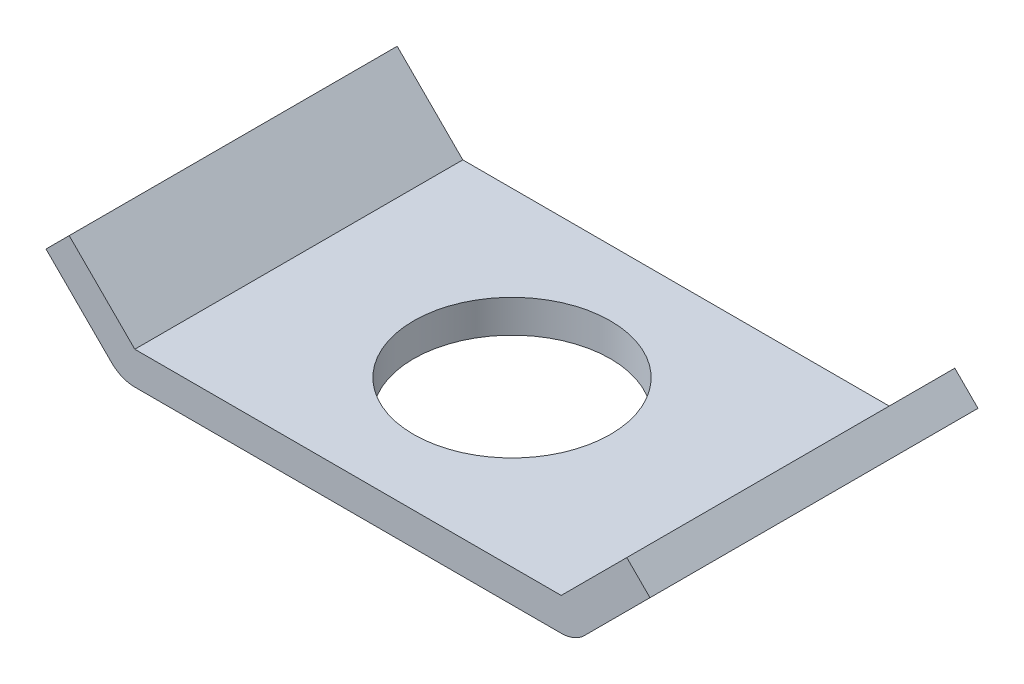
from build123d import *

# Parameters (mm, degrees)
BOSS_EXTRUDE1_DEPTH = 2.5
SKETCH2_R           = 1.5
CUT_EXTRUDE1_DEPTH  = 5


with BuildPart() as part:
    # Sketch1 → Boss-Extrude1 (new, symmetric)
    with BuildSketch(Plane.XY):
        with BuildLine():
            Line((-3.25, 0), (3.25, 0))
            Line((3.25, 0), (4.25, 1))
            Line((4.25, 1), (4.603553391, 0.646446609))
            Line((4.603553391, 0.646446609), (3.603553391, -0.353553391))
            ThreePointArc((3.603553391, -0.353553391), (3.441341716, -0.461939766), (3.25, -0.5))
            Line((3.25, -0.5), (-3.25, -0.5))
            ThreePointArc((-3.25, -0.5), (-3.441341716, -0.461939766), (-3.603553391, -0.353553391))
            Line((-3.603553391, -0.353553391), (-4.603553391, 0.646446609))
            Line((-4.603553391, 0.646446609), (-4.25, 1))
            Line((-4.25, 1), (-3.25, 0))
        make_face()
    extrude(amount=BOSS_EXTRUDE1_DEPTH, both=True)

    # Sketch2 → Cut-Extrude1 (cut)
    with BuildSketch(Plane.XZ.offset(0.5)):
        with Locations(Location((0, 0, 0), (0, 0, 270))):
            Circle(SKETCH2_R)
    extrude(amount=-CUT_EXTRUDE1_DEPTH, mode=Mode.SUBTRACT)


solid = part.part
